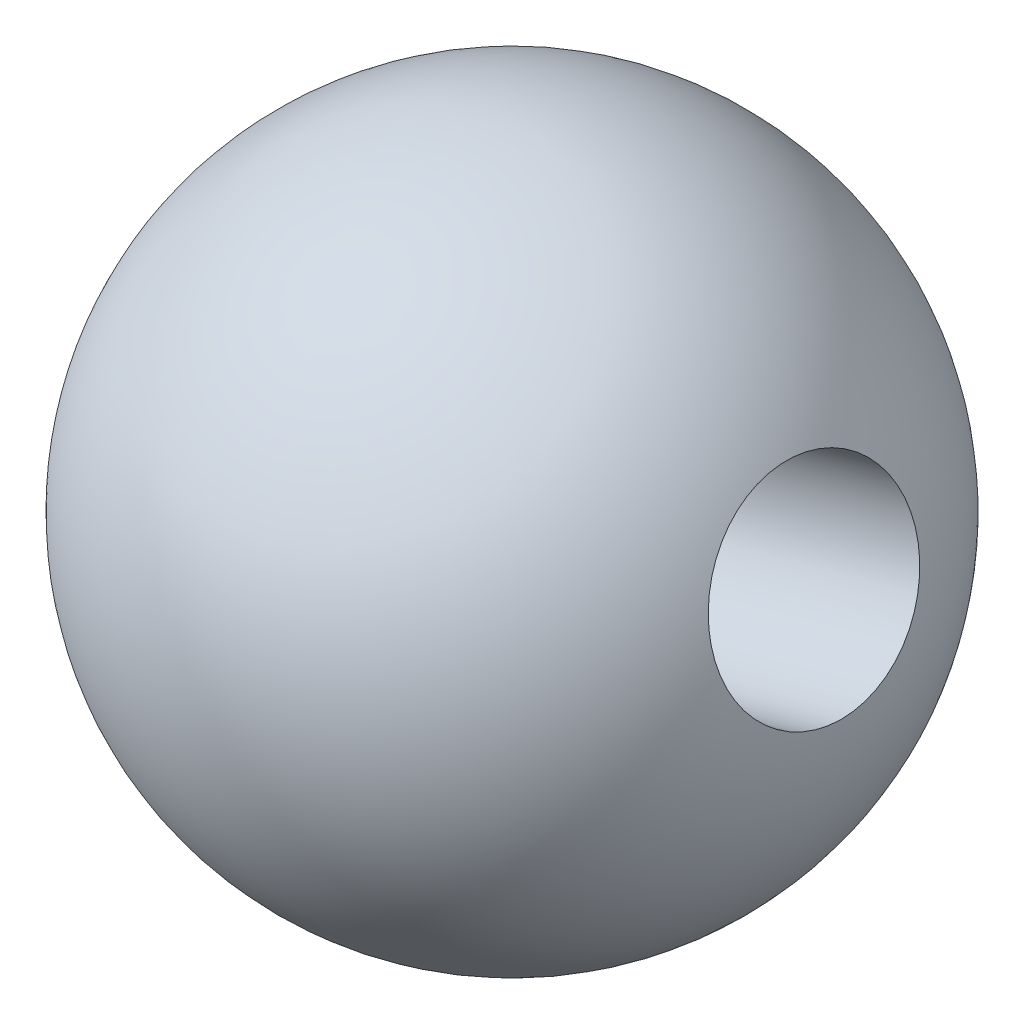
from build123d import *

# Parameters (mm, degrees)
SKETCH2_R          = 3.1
CUT_EXTRUDE1_DEPTH = 61.976165997


with BuildPart() as part:
    # Sketch1 → Revolve1 (revolve)
    with BuildSketch(Plane(origin=(-81.321101364, -22.508840822, 0), x_dir=(0, 0, 1), z_dir=(-0.9637630832539774, -0.26675966591069744, 0))):
        with BuildLine():
            Line((44.795, -3.521491587), (44.795, -23.521491587))
            ThreePointArc((44.795, -23.521491587), (54.795, -13.521491587), (44.795, -3.521491587))
        make_face()
    revolve(axis=Axis((-80.381709445, -25.902724411, 44.795), (0.2667596659106978, -0.9637630832539774, 0)))

    # Sketch2 → Cut-Extrude1 (cut, through all)
    with BuildSketch(Plane(origin=(-81.321101364, -22.508840822, 0), x_dir=(0, 0, 1), z_dir=(-0.9637630832539774, -0.26675966591069744, 0))):
        with Locations(Location((44.795, -13.521491587, 0), (0, 0, 270))):
            Circle(SKETCH2_R)
    extrude(amount=-CUT_EXTRUDE1_DEPTH, mode=Mode.SUBTRACT)


solid = part.part
